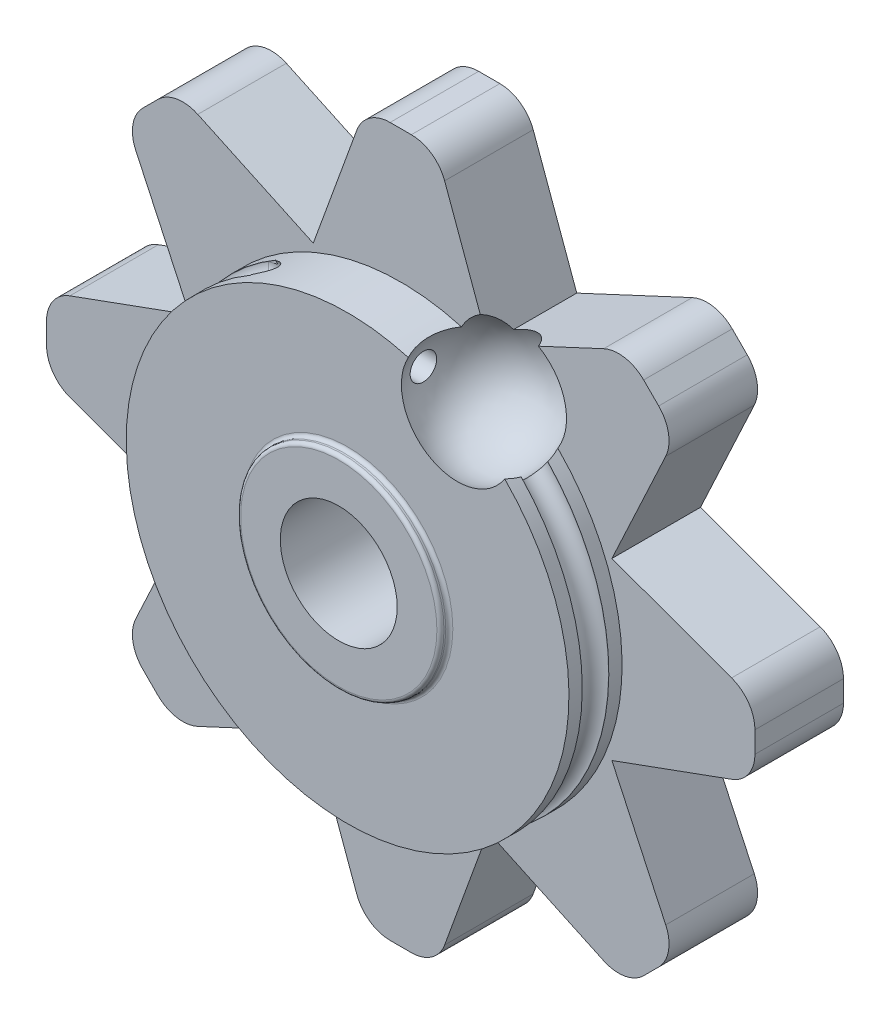
from build123d import *

# Parameters (mm, degrees)
SKETCH1_R                          = 6.25
BODY_DEPTH                         = 1.5
HOLE_TO_TRAP_CABLE_KNOT_DEPTH      = 10
HOLE_TO_TRAP_CABLE_KNOT_DEPTH_BACK = 9.965210539
SKETCH2_R                          = 0.375
THUMB_GRIP_DEPTH                   = 2.5
SKETCH13_R                         = 1.65
HOLE_FOR_SCREW_DEPTH               = 15.696938457
LIP_TO_CONTACT_HANDLE_DEPTH        = 0.25
LIP_TO_CONTACT_HANDLE_DEPTH_BACK   = 4.25
SKETCH21_R                         = 2.871579249
SKETCH21_R_2                       = 1.65
FILLET1_R                          = 0.1


with BuildPart() as part:
    # Sketch1 → body (new body)
    with BuildSketch(Plane.XY):
        Circle(SKETCH1_R)
    extrude(amount=BODY_DEPTH)

    # Sketch2 → Hole to trap cable knot (cut, two sides: drawn at the far end of the back side and taken through both)
    with BuildSketch(Plane(origin=(0, 0, 0), x_dir=(0, 0, -1), z_dir=(1, 0, 0)).offset(-HOLE_TO_TRAP_CABLE_KNOT_DEPTH_BACK)):
        with Locations((-0.75, 5.25)):
            Circle(SKETCH2_R)
        with Locations((-0.75, -4.75)):
            Circle(SKETCH2_R)
    extrude(amount=HOLE_TO_TRAP_CABLE_KNOT_DEPTH + HOLE_TO_TRAP_CABLE_KNOT_DEPTH_BACK, mode=Mode.SUBTRACT)

    # track for cable: sweep along a path in Sketch6
    with BuildLine(Plane.XY.offset(1.875)) as track_for_cable_path:
        ThreePointArc((-3.125, 5.412658774), (-0.078980905, -6.249500941), (3.260789939, 5.331955455))
    # Sketch10 → track for cable (sweep, cut)
    with BuildSketch(Plane(origin=(-5.412658774, 9.375, 0), x_dir=(-0.4999999999999889, 0.866025403784445, 0), z_dir=(-0.866025403784445, -0.4999999999999889, 0))):
        with BuildLine():
            Line((-4.583101682, -1.125), (-3.872701536, -1.125))
            Line((-3.872701536, -1.125), (-3.872701536, -0.374795087))
            Line((-3.872701536, -0.374795087), (-4.583101682, -0.374795087))
            ThreePointArc((-4.583101682, -0.374795087), (-4.958204138, -0.749897543), (-4.583101682, -1.125))
        make_face()
    sweep(path=track_for_cable_path.line, mode=Mode.SUBTRACT)

    # Sketch14 → thumb grip (add)
    with BuildSketch(Plane(origin=(0, 0, 0), x_dir=(-1, 0, 0), z_dir=(0, 0, -1))):
        with BuildLine():
            Line((5.729357486, 7.4822541), (2.469632038, 5.96221916))
            Line((2.469632038, 5.96221916), (1.239485083, 9.342020143))
            ThreePointArc((1.239485083, 9.342020143), (0.873368898, 9.819152044), (0.299792462, 10))
            Line((0.299792462, 10), (-0.299792462, 10))
            ThreePointArc((-0.299792462, 10), (-0.873368898, 9.819152044), (-1.239485083, 9.342020143))
            Line((-1.239485083, 9.342020143), (-2.469632038, 5.96221916))
            Line((-2.469632038, 5.96221916), (-5.729357486, 7.4822541))
            ThreePointArc((-5.729357486, 7.4822541), (-6.325623926, 7.560754066), (-6.859082529, 7.283053095))
            Line((-6.859082529, 7.283053095), (-7.283053095, 6.859082529))
            ThreePointArc((-7.283053095, 6.859082529), (-7.560754066, 6.325623926), (-7.4822541, 5.729357486))
            Line((-7.4822541, 5.729357486), (-5.96221916, 2.469632038))
            Line((-5.96221916, 2.469632038), (-9.342020143, 1.239485083))
            ThreePointArc((-9.342020143, 1.239485083), (-9.819152044, 0.873368898), (-10, 0.299792462))
            Line((-10, 0.299792462), (-10, -0.299792462))
            ThreePointArc((-10, -0.299792462), (-9.819152044, -0.873368898), (-9.342020143, -1.239485083))
            Line((-9.342020143, -1.239485083), (-5.96221916, -2.469632038))
            Line((-5.96221916, -2.469632038), (-7.4822541, -5.729357486))
            ThreePointArc((-7.4822541, -5.729357486), (-7.560754066, -6.325623926), (-7.283053095, -6.859082529))
            Line((-7.283053095, -6.859082529), (-6.859082529, -7.283053095))
            ThreePointArc((-6.859082529, -7.283053095), (-6.325623926, -7.560754066), (-5.729357486, -7.4822541))
            Line((-5.729357486, -7.4822541), (-2.469632038, -5.96221916))
            Line((-2.469632038, -5.96221916), (-1.239485083, -9.342020143))
            ThreePointArc((-1.239485083, -9.342020143), (-0.873368898, -9.819152044), (-0.299792462, -10))
            Line((-0.299792462, -10), (0.299792462, -10))
            ThreePointArc((0.299792462, -10), (0.873368898, -9.819152044), (1.239485083, -9.342020143))
            Line((1.239485083, -9.342020143), (2.469632038, -5.96221916))
            Line((2.469632038, -5.96221916), (5.729357486, -7.4822541))
            ThreePointArc((5.729357486, -7.4822541), (6.325623926, -7.560754066), (6.859082529, -7.283053095))
            Line((6.859082529, -7.283053095), (7.283053095, -6.859082529))
            ThreePointArc((7.283053095, -6.859082529), (7.560754066, -6.325623926), (7.4822541, -5.729357486))
            Line((7.4822541, -5.729357486), (5.96221916, -2.469632038))
            Line((5.96221916, -2.469632038), (9.342020143, -1.239485083))
            ThreePointArc((9.342020143, -1.239485083), (9.819152044, -0.873368898), (10, -0.299792462))
            Line((10, -0.299792462), (10, 0.299792462))
            ThreePointArc((10, 0.299792462), (9.819152044, 0.873368898), (9.342020143, 1.239485083))
            Line((9.342020143, 1.239485083), (5.96221916, 2.469632038))
            Line((5.96221916, 2.469632038), (7.4822541, 5.729357486))
            ThreePointArc((7.4822541, 5.729357486), (7.560754066, 6.325623926), (7.283053095, 6.859082529))
            Line((7.283053095, 6.859082529), (6.859082529, 7.283053095))
            ThreePointArc((6.859082529, 7.283053095), (6.325623926, 7.560754066), (5.729357486, 7.4822541))
        make_face()
    extrude(amount=THUMB_GRIP_DEPTH)

    # Sketch13 → hole for screw (cut, through all)
    with BuildSketch(Plane.XY.offset(1.5)):
        Circle(SKETCH13_R)
    extrude(amount=-HOLE_FOR_SCREW_DEPTH, mode=Mode.SUBTRACT)

    # Sketch20 → trap for ball (revolve, cut)
    with BuildSketch(Plane(origin=(3.1, 0, 0), x_dir=(0, 0, -1), z_dir=(1, 0, 0))):
        with BuildLine():
            Line((-0.75, 7), (-0.75, 3.5))
            ThreePointArc((-0.75, 3.5), (1, 5.25), (-0.75, 7))
        make_face()
    revolve(axis=Axis((3.1, 7.793428849, 0.75), (0, -1, 0)), mode=Mode.SUBTRACT)

    # Sketch21 → lip to contact handle (add, two sides: drawn at the far end of the back side and taken through both)
    with BuildSketch(Plane.XY.offset(1.5).offset(-LIP_TO_CONTACT_HANDLE_DEPTH_BACK)):
        Circle(SKETCH21_R)
        Circle(SKETCH21_R_2, mode=Mode.SUBTRACT)
    extrude(amount=LIP_TO_CONTACT_HANDLE_DEPTH + LIP_TO_CONTACT_HANDLE_DEPTH_BACK)

    # Fillet1
    fillet1_edges = [part.edges().sort_by_distance(p)[0] for p in [
        (-2.871579249, 0, 1.5),
        (-2.871579249, 0, 1.75),
        (-2.871579249, 0, -2.5),
        (-2.871579249, 0, -2.75),
    ]]
    fillet(fillet1_edges, radius=FILLET1_R)


solid = part.part
